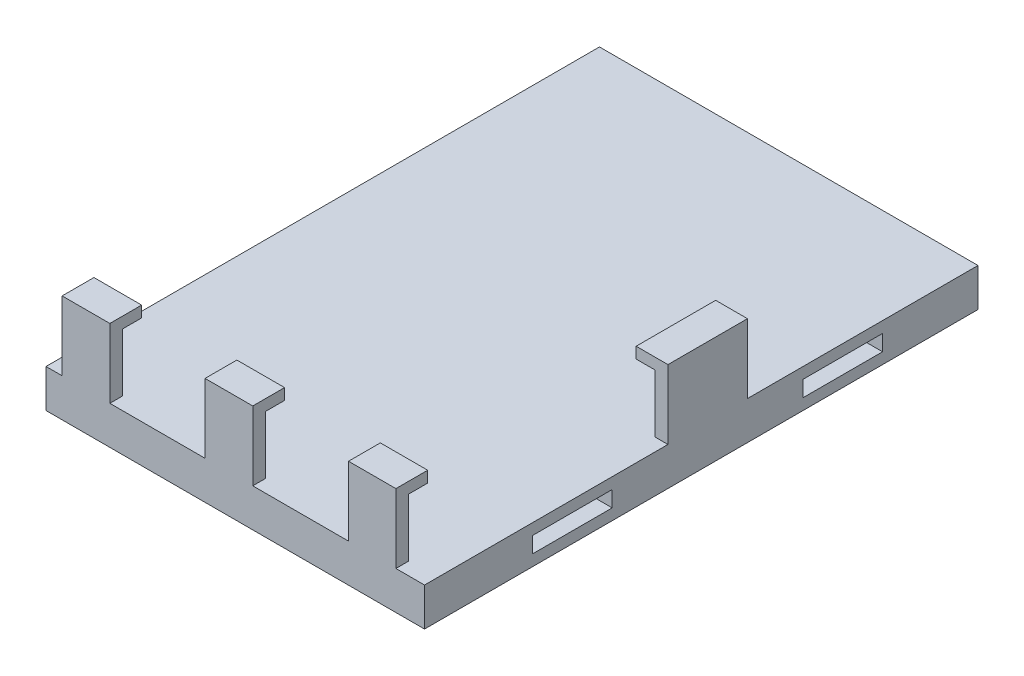
from build123d import *

# Parameters (mm, degrees)
SKETCH1_W             = 58.42
SKETCH1_H             = 86.36
BASEPLATE_DEPTH       = 2.032
SKETCH5_W             = 7.62
SKETCH5_H             = 2.032
BOSS_EXTRUDE3_DEPTH   = 9.271
SKETCH5_W_2           = 7.656133635
BOSS_EXTRUDE3_2_DEPTH = 9.271
SKETCH5_W_3           = 7.565007612
BOSS_EXTRUDE3_3_DEPTH = 9.271
SKETCH5_W_4           = 2.032
SKETCH5_H_2           = 12.7
BOSS_EXTRUDE3_4_DEPTH = 9.271
SKETCH5_2_W           = 7.62
SKETCH5_2_H           = 2.032
SKETCH5_2_W_2         = 7.656133635
SKETCH5_2_W_3         = 7.565007612
SKETCH5_2_W_4         = 2.032
SKETCH5_2_H_2         = 12.7
BOSS_EXTRUDE4_DEPTH   = 2.032
SKETCH6_W             = 7.565007612
SKETCH6_H             = 1.778
BOSS_EXTRUDE5_DEPTH   = 3.048
SKETCH6_W_2           = 7.62
BOSS_EXTRUDE5_2_DEPTH = 3.048
BOSS_EXTRUDE5_3_DEPTH = 3.048
SKETCH6_2_W           = 7.565007612
SKETCH6_2_H           = 1.778
SKETCH6_2_W_2         = 7.62
BOSS_EXTRUDE6_DEPTH   = 2.032
SKETCH7_W             = 15.203866365
SKETCH7_H             = 2.032
SKETCH7_W_2           = 15.294992388
SKETCH7_W_3           = 2.54
SKETCH7_W_4           = 2.032
SKETCH7_H_2           = 36.817012066
BOSS_EXTRUDE7_DEPTH   = 2.032
SKETCH9_W             = 12.7
SKETCH9_H             = 1.778
BOSS_EXTRUDE8_DEPTH   = 3.048
SKETCH9_2_W           = 12.7
SKETCH9_2_H           = 1.778
BOSS_EXTRUDE9_DEPTH   = 2.032
SKETCH11_W            = 60.452
SKETCH11_H            = 88.392
BOSS_EXTRUDE10_DEPTH  = 4.064
SKETCH12_W            = 12.7
SKETCH12_H            = 2.54
CUT_EXTRUDE1_DEPTH    = 77.613848676


with BuildPart() as part:
    # Sketch1 → basePlate (new body)
    with BuildSketch(Plane(origin=(0, 0, 0), x_dir=(1, 0, 0), z_dir=(0, 1, 0))):
        Rectangle(SKETCH1_W, SKETCH1_H)
    extrude(amount=BASEPLATE_DEPTH)



with BuildPart() as body_2:
    # Sketch5 → Boss-Extrude3 (new body)
    with BuildSketch(Plane(origin=(0, 2.032, 0), x_dir=(1, 0, 0), z_dir=(0, 1, 0))):
        with Locations((0, -44.196)):
            Rectangle(SKETCH5_W, SKETCH5_H)
    extrude(amount=BOSS_EXTRUDE3_DEPTH)


with BuildPart() as body_3:
    # Sketch5 → Boss-Extrude3 2 (new body)
    with BuildSketch(Plane(origin=(0, 2.032, 0), x_dir=(1, 0, 0), z_dir=(0, 1, 0))):
        with Locations((-22.841933183, -44.196)):
            Rectangle(SKETCH5_W_2, SKETCH5_H)
    extrude(amount=BOSS_EXTRUDE3_2_DEPTH)


with BuildPart() as body_4:
    # Sketch5 → Boss-Extrude3 3 (new body)
    with BuildSketch(Plane(origin=(0, 2.032, 0), x_dir=(1, 0, 0), z_dir=(0, 1, 0))):
        with Locations((22.887496194, -44.196)):
            Rectangle(SKETCH5_W_3, SKETCH5_H)
    extrude(amount=BOSS_EXTRUDE3_3_DEPTH)


with BuildPart() as body_5:
    # Sketch5 → Boss-Extrude3 4 (new body)
    with BuildSketch(Plane(origin=(0, 2.032, 0), x_dir=(1, 0, 0), z_dir=(0, 1, 0))):
        with Locations((30.226, 0.012987934)):
            Rectangle(SKETCH5_W_4, SKETCH5_H_2)
    extrude(amount=BOSS_EXTRUDE3_4_DEPTH)


with BuildPart() as part_1:
    add(part.part)

    add(body_2.part)  # Boss-Extrude4 merges body 2

    add(body_3.part)  # Boss-Extrude4 merges body 3

    add(body_4.part)  # Boss-Extrude4 merges body 4

    add(body_5.part)  # Boss-Extrude4 merges body 5
    # Sketch5<2> → Boss-Extrude4 (add)
    with BuildSketch(Plane(origin=(0, 2.032, 0), x_dir=(1, 0, 0), z_dir=(0, 1, 0))):
        with Locations((0, -44.196)):
            Rectangle(SKETCH5_2_W, SKETCH5_2_H)
        with Locations((-22.841933183, -44.196)):
            Rectangle(SKETCH5_2_W_2, SKETCH5_2_H)
        with Locations((22.887496194, -44.196)):
            Rectangle(SKETCH5_2_W_3, SKETCH5_2_H)
        with Locations((30.226, 0.012987934)):
            Rectangle(SKETCH5_2_W_4, SKETCH5_2_H_2)
    extrude(amount=-BOSS_EXTRUDE4_DEPTH)



with BuildPart() as body_2_2:
    # Sketch6 → Boss-Extrude5 (new body)
    with BuildSketch(Plane(origin=(0, 0, 43.18), x_dir=(-1, 0, 0), z_dir=(0, 0, -1))):
        with Locations((-22.887496194, 12.192)):
            Rectangle(SKETCH6_W, SKETCH6_H)
    extrude(amount=BOSS_EXTRUDE5_DEPTH)


with BuildPart() as body_3_2:
    # Sketch6 → Boss-Extrude5 2 (new body)
    with BuildSketch(Plane(origin=(0, 0, 43.18), x_dir=(-1, 0, 0), z_dir=(0, 0, -1))):
        with Locations((0, 12.192)):
            Rectangle(SKETCH6_W_2, SKETCH6_H)
    extrude(amount=BOSS_EXTRUDE5_2_DEPTH)


with BuildPart() as body_4_2:
    # Sketch6 → Boss-Extrude5 3 (new body)
    with BuildSketch(Plane(origin=(0, 0, 43.18), x_dir=(-1, 0, 0), z_dir=(0, 0, -1))):
        with Locations((22.823866365, 12.192)):
            Rectangle(SKETCH6_W_2, SKETCH6_H)
    extrude(amount=BOSS_EXTRUDE5_3_DEPTH)


with BuildPart() as part_2:
    add(part_1.part)

    add(body_2_2.part)  # Boss-Extrude6 merges body 2 2

    add(body_3_2.part)  # Boss-Extrude6 merges body 3 2

    add(body_4_2.part)  # Boss-Extrude6 merges body 4 2
    # Sketch6<2> → Boss-Extrude6 (add)
    with BuildSketch(Plane(origin=(0, 0, 43.18), x_dir=(-1, 0, 0), z_dir=(0, 0, -1))):
        with Locations((-22.887496194, 12.192)):
            Rectangle(SKETCH6_2_W, SKETCH6_2_H)
        with Locations((0, 12.192)):
            Rectangle(SKETCH6_2_W_2, SKETCH6_2_H)
        with Locations((22.823866365, 12.192)):
            Rectangle(SKETCH6_2_W_2, SKETCH6_2_H)
    extrude(amount=-BOSS_EXTRUDE6_DEPTH)

    # Sketch7 → Boss-Extrude7 (add)
    with BuildSketch(Plane.XZ):
        with Locations((-11.411933183, 44.196)):
            Rectangle(SKETCH7_W, SKETCH7_H)
        with Locations((11.457496194, 44.196)):
            Rectangle(SKETCH7_W_2, SKETCH7_H)
        with Locations((-27.94, 44.196)):
            Rectangle(SKETCH7_W_3, SKETCH7_H)
        Polygon((29.21, 43.18), (26.67, 43.18), (26.67, 45.212), (29.21, 45.212), (31.242, 45.212), (31.242, 6.337012066), (29.21, 6.337012066), align=None)
        with Locations((30.226, -24.771493967)):
            Rectangle(SKETCH7_W_4, SKETCH7_H_2)
    extrude(amount=-BOSS_EXTRUDE7_DEPTH)



with BuildPart() as body_2_3:
    # Sketch9 → Boss-Extrude8 (new body)
    with BuildSketch(Plane.ZY.offset(-29.21)):
        with Locations((-0.012987934, 12.192)):
            Rectangle(SKETCH9_W, SKETCH9_H)
    extrude(amount=BOSS_EXTRUDE8_DEPTH)


with BuildPart() as part_3:
    add(part_2.part)

    add(body_2_3.part)  # Boss-Extrude9 merges body 2 3
    # Sketch9<2> → Boss-Extrude9 (add)
    with BuildSketch(Plane.ZY.offset(-29.21)):
        with Locations((-0.012987934, 12.192)):
            Rectangle(SKETCH9_2_W, SKETCH9_2_H)
    extrude(amount=-BOSS_EXTRUDE9_DEPTH)

    # Sketch11 → Boss-Extrude10 (add)
    with BuildSketch(Plane.XZ):
        with Locations((1.016, 1.016)):
            Rectangle(SKETCH11_W, SKETCH11_H)
    extrude(amount=BOSS_EXTRUDE10_DEPTH)

    # Sketch12 → Cut-Extrude1 (cut, through all)
    with BuildSketch(Plane.ZY.offset(29.21)):
        with Locations((-21.59, -1.016)):
            Rectangle(SKETCH12_W, SKETCH12_H)
        with Locations((21.59, -1.016)):
            Rectangle(SKETCH12_W, SKETCH12_H)
    extrude(amount=-CUT_EXTRUDE1_DEPTH, mode=Mode.SUBTRACT)


solid = part_3.part
